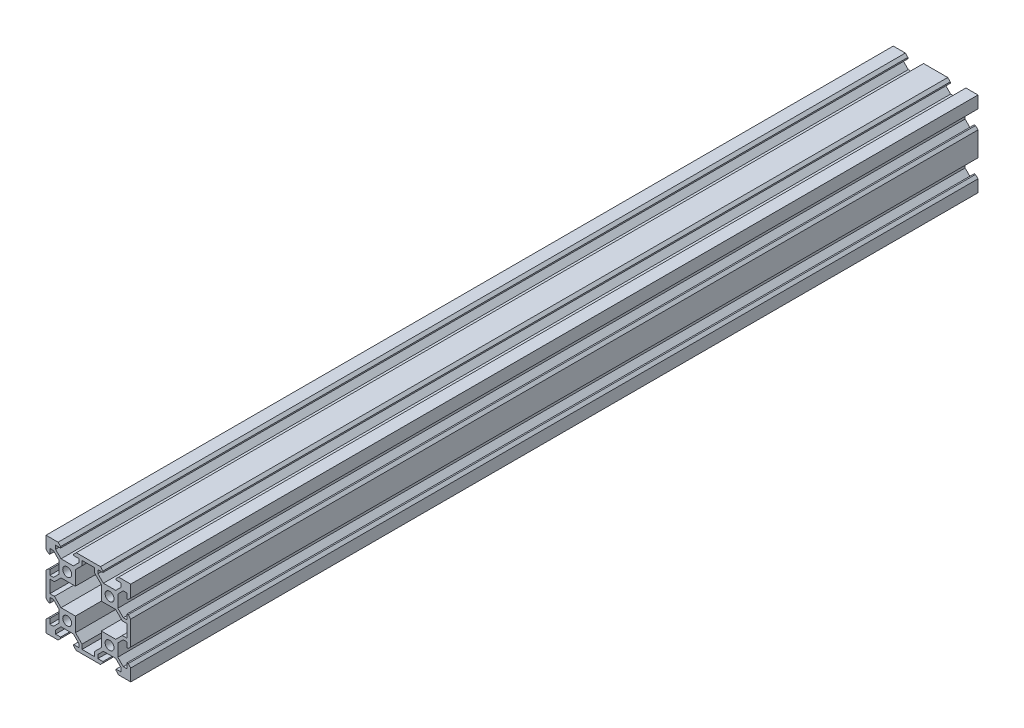
from build123d import *

# Parameters (mm, degrees)
SKETCH_1_R      = 2.1
EXTRUDE_1_DEPTH = 400


with BuildPart() as part:
    # 草图1 → 凸台-拉伸1 (new body)
    with BuildSketch(Plane.XY):
        Polygon((5.71, 20), (-5.71, 20), (-6.9, 18.81), (-6.9, 18.2), (-4.5, 18.2), (-4.5, 16.489949494), (-7.089949494, 13.9), (-12.910050506, 13.9), (-15.5, 16.489949494), (-15.5, 18.2), (-13.1, 18.2), (-13.1, 18.81), (-14.29, 20), (-20, 20), (-20, 14.29), (-18.81, 13.1), (-18.2, 13.1), (-18.2, 15.5), (-16.489949494, 15.5), (-13.9, 12.910050506), (-13.9, 7.089949494), (-16.489949494, 4.5), (-18.2, 4.5), (-18.2, 6.9), (-18.81, 6.9), (-20, 5.71), (-20, -5.71), (-18.81, -6.9), (-18.2, -6.9), (-18.2, -4.5), (-16.489949494, -4.5), (-13.9, -7.089949494), (-13.9, -12.910050506), (-16.489949494, -15.5), (-18.2, -15.5), (-18.2, -13.1), (-18.81, -13.1), (-20, -14.29), (-20, -20), (-14.29, -20), (-13.1, -18.81), (-13.1, -18.2), (-15.5, -18.2), (-15.5, -16.489949494), (-12.910050506, -13.9), (-7.089949494, -13.9), (-4.5, -16.489949494), (-4.5, -18.2), (-6.9, -18.2), (-6.9, -18.81), (-5.71, -20), (5.71, -20), (6.9, -18.81), (6.9, -18.2), (4.5, -18.2), (4.5, -16.489949494), (7.089949494, -13.9), (12.910050506, -13.9), (15.5, -16.489949494), (15.5, -18.2), (13.1, -18.2), (13.1, -18.81), (14.29, -20), (20, -20), (20, -14.29), (18.81, -13.1), (18.2, -13.1), (18.2, -15.5), (16.489949494, -15.5), (13.9, -12.910050506), (13.9, -7.089949494), (16.489949494, -4.5), (18.2, -4.5), (18.2, -6.9), (18.81, -6.9), (20, -5.71), (20, 5.71), (18.81, 6.9), (18.2, 6.9), (18.2, 4.5), (16.489949494, 4.5), (13.9, 7.089949494), (13.9, 12.910050506), (16.489949494, 15.5), (18.2, 15.5), (18.2, 13.1), (18.81, 13.1), (20, 14.29), (20, 20), (14.29, 20), (13.1, 18.81), (13.1, 18.2), (15.5, 18.2), (15.5, 16.489949494), (12.910050506, 13.9), (7.089949494, 13.9), (4.5, 16.489949494), (4.5, 18.2), (6.9, 18.2), (6.9, 18.81), align=None)
        with Locations((-10, 10)):
            Circle(SKETCH_1_R, mode=Mode.SUBTRACT)
        with Locations(Location((-10, -10, 0), (0, 0, 180))):
            Circle(SKETCH_1_R, mode=Mode.SUBTRACT)
        with Locations((10, -10)):
            Circle(SKETCH_1_R, mode=Mode.SUBTRACT)
        with Locations(Location((10, 10, 0), (0, 0, 180))):
            Circle(SKETCH_1_R, mode=Mode.SUBTRACT)
        Polygon((-6.1, 6.1), (-6.1, 12.910050506), (-3, 16.010050506), (-3, 18.2), (3, 18.2), (3, 16.010050506), (6.1, 12.910050506), (6.1, 6.1), (12.910050506, 6.1), (16.010050506, 3), (18.2, 3), (18.2, -3), (16.010050506, -3), (12.910050506, -6.1), (6.1, -6.1), (6.1, -12.910050506), (3, -16.010050506), (3, -18.2), (-3, -18.2), (-3, -16.010050506), (-6.1, -12.910050506), (-6.1, -6.1), (-12.910050506, -6.1), (-16.010050506, -3), (-18.2, -3), (-18.2, 3), (-16.010050506, 3), (-12.910050506, 6.1), align=None, mode=Mode.SUBTRACT)
    extrude(amount=EXTRUDE_1_DEPTH)


solid = part.part
